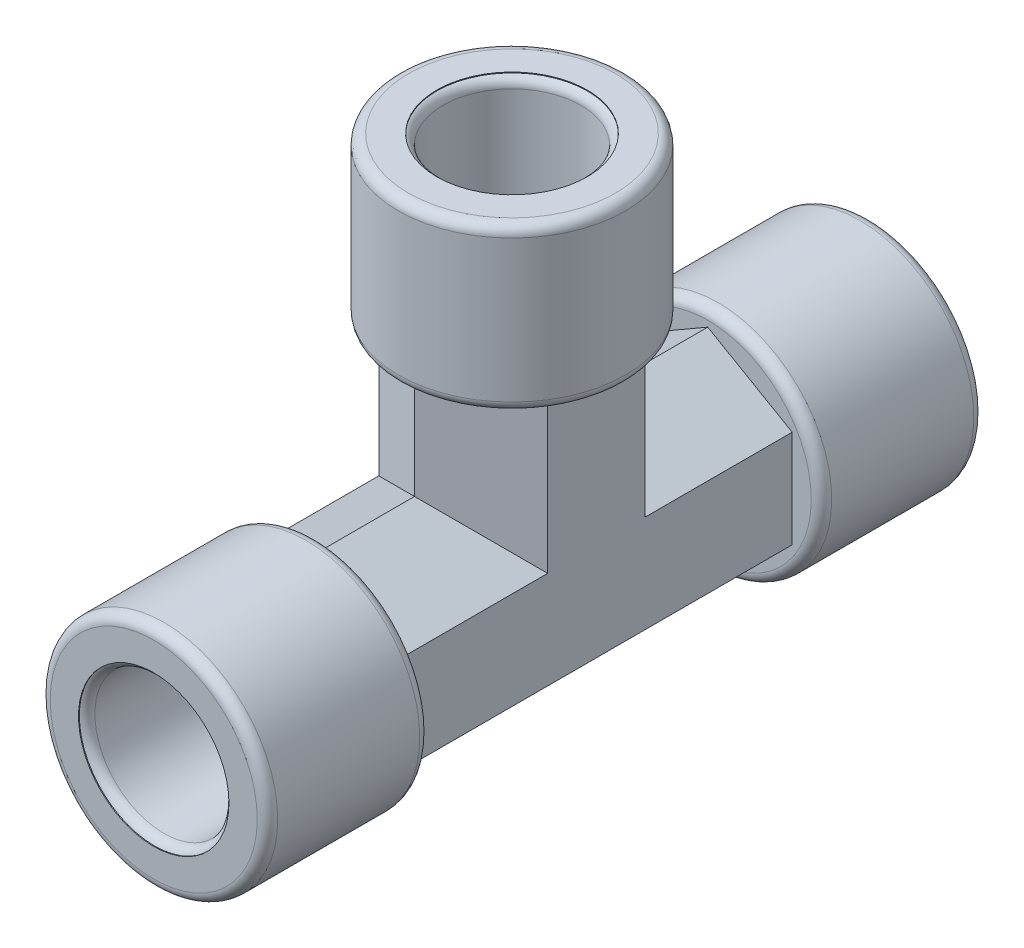
from build123d import *

# Parameters (mm, degrees)
RESSALTO_EXTRUS_O1_DEPTH   = 35
RESSALTO_EXTRUS_O3_DEPTH   = 17.74
ESBO_O5_R                  = 2.38125
CORTE_EXTRUS_O1_DEPTH      = 40.455274105
CORTE_EXTRUS_O2_REACH      = 43.814
CORTE_EXTRUS_O2_END_RADIUS = 2.38125
ESBO_O6_R                  = 2.38125
ESBO_O7_R                  = 3.3734375
CORTE_EXTRUS_O3_DEPTH      = 6.35
CORTE_EXTRUS_O4_START      = -6.35
ESBO_O8_R                  = 3.3734375
CORTE_EXTRUS_O4_DEPTH      = 6.35
ESBO_O9_R                  = 3.3734375
CORTE_EXTRUS_O5_DEPTH      = 6.35
FILETE1_R                  = 0.5
FILETE2_R                  = 0.5
ESBO_O10_R                 = 5.55625
ESBO_O10_R_2               = 3.675
RESSALTO_EXTRUS_O4_DEPTH   = 7.9375
FILETE3_R                  = 0.5
RESSALTO_EXTRUS_O5_START   = -7.9375
ESBO_O11_R                 = 5.55625
ESBO_O11_R_2               = 3.675
RESSALTO_EXTRUS_O5_DEPTH   = 7.9375
FILETE4_R                  = 0.5
ESBO_O12_R                 = 5.55625
ESBO_O12_R_2               = 3.675
RESSALTO_EXTRUS_O6_DEPTH   = 7.9375
FILETE5_R                  = 0.5


with BuildPart() as part:
    # Esboço2 → Ressalto-extrusão1 (new body)
    with BuildSketch(Plane.XY):
        Polygon((0, 4.7625), (-4.124445986, 2.38125), (-4.124445986, -2.38125), (0, -4.7625), (4.124445986, -2.38125), (4.124445986, 2.38125), align=None)
    extrude(amount=RESSALTO_EXTRUS_O1_DEPTH)

    # Esboço4 → Ressalto-extrusão3 (add)
    with BuildSketch(Plane(origin=(0, 0, 0), x_dir=(1, 0, 0), z_dir=(0, 1, 0))):
        Polygon((0, -12.7375), (-4.124445986, -15.11875), (-4.124445986, -19.88125), (0, -22.2625), (4.124445986, -19.88125), (4.124445986, -15.11875), align=None)
    extrude(amount=RESSALTO_EXTRUS_O3_DEPTH)

    # Esboço5 → Corte-extrusão1 (cut, through all)
    with BuildSketch(Plane.XY):
        Circle(ESBO_O5_R)
    extrude(amount=CORTE_EXTRUS_O1_DEPTH, mode=Mode.SUBTRACT)

    # Corte-extrusão2: up to this cylinder (the profile starts outside it)
    corte_extrus_o2_end = Plane(origin=(0, 0, 17.5), z_dir=(0, 0, -1)) * Cylinder(CORTE_EXTRUS_O2_END_RADIUS, 93.3905, mode=Mode.PRIVATE)
    # Esboço6 → Corte-extrusão2 (cut, up to the surface)
    with BuildSketch(Plane(origin=(0, 17.74, 0), x_dir=(1, 0, 0), z_dir=(0, 1, 0)), mode=Mode.PRIVATE) as corte_extrus_o2_sk1:
        with Locations(Location((0, -17.5, 0), (0, 0, 270))):
            Circle(ESBO_O6_R)
    corte_extrus_o2_tool1 = extrude(corte_extrus_o2_sk1.sketch, amount=-CORTE_EXTRUS_O2_REACH, mode=Mode.PRIVATE) - corte_extrus_o2_end
    add(corte_extrus_o2_tool1.solids().sort_by_distance((0, 17.74, 17.5))[0], mode=Mode.SUBTRACT)

    # Esboço7 → Corte-extrusão3 (cut)
    with BuildSketch(Plane(origin=(0, 0, 0), x_dir=(-1, 0, 0), z_dir=(0, 0, -1))):
        Circle(ESBO_O7_R)
    extrude(amount=-CORTE_EXTRUS_O3_DEPTH, mode=Mode.SUBTRACT)

    # Esboço8 → Corte-extrusão4 (cut)
    with BuildSketch(Plane.XY.offset(35).offset(CORTE_EXTRUS_O4_START)):
        with Locations(Location((0, 0, 0), (0, 0, 180))):
            Circle(ESBO_O8_R)
    extrude(amount=CORTE_EXTRUS_O4_DEPTH, mode=Mode.SUBTRACT)

    # Esboço9 → Corte-extrusão5 (cut)
    with BuildSketch(Plane(origin=(0, 17.74, 0), x_dir=(1, 0, 0), z_dir=(0, 1, 0))):
        with Locations(Location((0, -17.5, 0), (0, 0, 270))):
            Circle(ESBO_O9_R)
    extrude(amount=-CORTE_EXTRUS_O5_DEPTH, mode=Mode.SUBTRACT)

    # Filete1
    filete1_edges = [part.edges().sort_by_distance(p)[0] for p in [
        (3.3734375, 0, 0),
    ]]
    fillet(filete1_edges, radius=FILETE1_R)

    # Filete2
    filete2_edges = [part.edges().sort_by_distance(p)[0] for p in [
        (3.3734375, 0, 35),
        (0, 17.74, 14.1265625),
    ]]
    fillet(filete2_edges, radius=FILETE2_R)

    # Esboço10 → Ressalto-extrusão4 (add)
    with BuildSketch(Plane.XY.offset(35)):
        Circle(ESBO_O10_R)
        Circle(ESBO_O10_R_2, mode=Mode.SUBTRACT)
    extrude(amount=-RESSALTO_EXTRUS_O4_DEPTH)

    # Filete3
    filete3_edges = [part.edges().sort_by_distance(p)[0] for p in [
        (-5.55625, 0, 35),
        (-5.55625, 0, 27.0625),
    ]]
    fillet(filete3_edges, radius=FILETE3_R)

    # Esboço11 → Ressalto-extrusão5 (add)
    with BuildSketch(Plane(origin=(0, 0, 0), x_dir=(-1, 0, 0), z_dir=(0, 0, -1)).offset(RESSALTO_EXTRUS_O5_START)):
        with Locations(Location((0, 0, 0), (0, 0, 180))):
            Circle(ESBO_O11_R)
        with Locations(Location((0, 0, 0), (0, 0, 180))):
            Circle(ESBO_O11_R_2, mode=Mode.SUBTRACT)
    extrude(amount=RESSALTO_EXTRUS_O5_DEPTH)

    # Filete4
    filete4_edges = [part.edges().sort_by_distance(p)[0] for p in [
        (-5.55625, 0, 0),
        (-5.55625, 0, 7.9375),
    ]]
    fillet(filete4_edges, radius=FILETE4_R)

    # Esboço12 → Ressalto-extrusão6 (add)
    with BuildSketch(Plane(origin=(0, 17.74, 0), x_dir=(1, 0, 0), z_dir=(0, 1, 0))):
        with Locations(Location((0, -17.5, 0), (0, 0, 270))):
            Circle(ESBO_O12_R)
        with Locations(Location((0, -17.5, 0), (0, 0, 270))):
            Circle(ESBO_O12_R_2, mode=Mode.SUBTRACT)
    extrude(amount=-RESSALTO_EXTRUS_O6_DEPTH)

    # Filete5
    filete5_edges = [part.edges().sort_by_distance(p)[0] for p in [
        (0, 17.74, 11.94375),
        (0, 9.8025, 11.94375),
    ]]
    fillet(filete5_edges, radius=FILETE5_R)


solid = part.part
